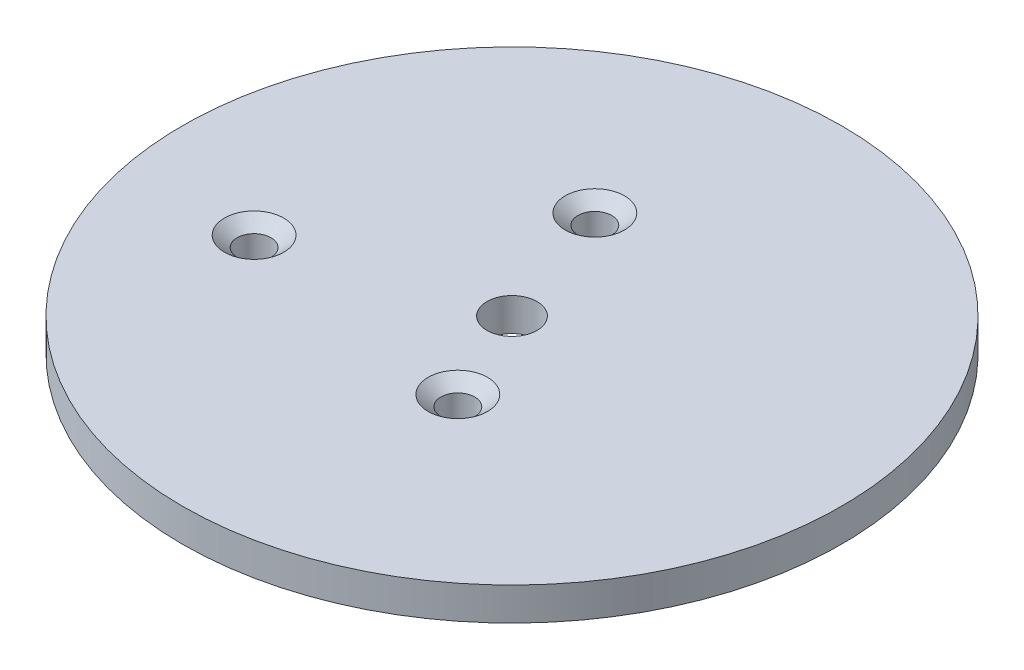
from build123d import *

# Parameters (mm, degrees)
SKETCH1_R                                         = 31.75
BOSS_EXTRUDE1_DEPTH                               = 3.175
SKETCH2_R                                         = 2.413
SKETCH2_R_2                                       = 0.79375
CUT_EXTRUDE1_DEPTH                                = 46.01339384
CSK_FOR_4_FLAT_HEAD_MACHINE_SCREW_100_D           = 3.2639
CSK_FOR_4_FLAT_HEAD_MACHINE_SCREW_100_CSINK_D     = 5.715
CSK_FOR_4_FLAT_HEAD_MACHINE_SCREW_100_CSINK_ANGLE = 100


with BuildPart() as part:
    # Sketch1 → Boss-Extrude1 (new body)
    with BuildSketch(Plane(origin=(0, 0, 0), x_dir=(1, 0, 0), z_dir=(0, 1, 0))):
        with Locations(Location((0, 0, 0), (0, 0, 270))):
            Circle(SKETCH1_R)
    extrude(amount=BOSS_EXTRUDE1_DEPTH)

    # Sketch2 → Cut-Extrude1 (cut, through all)
    with BuildSketch(Plane(origin=(0, 3.175, 0), x_dir=(1, 0, 0), z_dir=(0, 1, 0))):
        with Locations(Location((0, 0, 0), (0, 0, 270))):
            Circle(SKETCH2_R)
        with Locations(Location((-19.165786135, -5.680153436, 0), (0, 0, 270))):
            Circle(SKETCH2_R_2)
        with Locations(Location((-4.607724074, 12.589841237, 0), (0, 0, 270))):
            Circle(SKETCH2_R_2)
        with Locations(Location((3.935524409, -9.152807674, 0), (0, 0, 270))):
            Circle(SKETCH2_R_2)
    extrude(amount=-CUT_EXTRUDE1_DEPTH, mode=Mode.SUBTRACT)

    # CSK for #4 Flat Head Machine Screw (100)1 (through all)
    with Locations(Plane(origin=(0, 3.175, 0), x_dir=(1, 0, 0), z_dir=(0, 1, 0))):
        with Locations((3.935524409, -9.152807674), (-19.165786135, -5.680153436), (-4.607724074, 12.589841237)):
            CounterSinkHole(CSK_FOR_4_FLAT_HEAD_MACHINE_SCREW_100_D / 2, CSK_FOR_4_FLAT_HEAD_MACHINE_SCREW_100_CSINK_D / 2, counter_sink_angle=CSK_FOR_4_FLAT_HEAD_MACHINE_SCREW_100_CSINK_ANGLE)


solid = part.part
